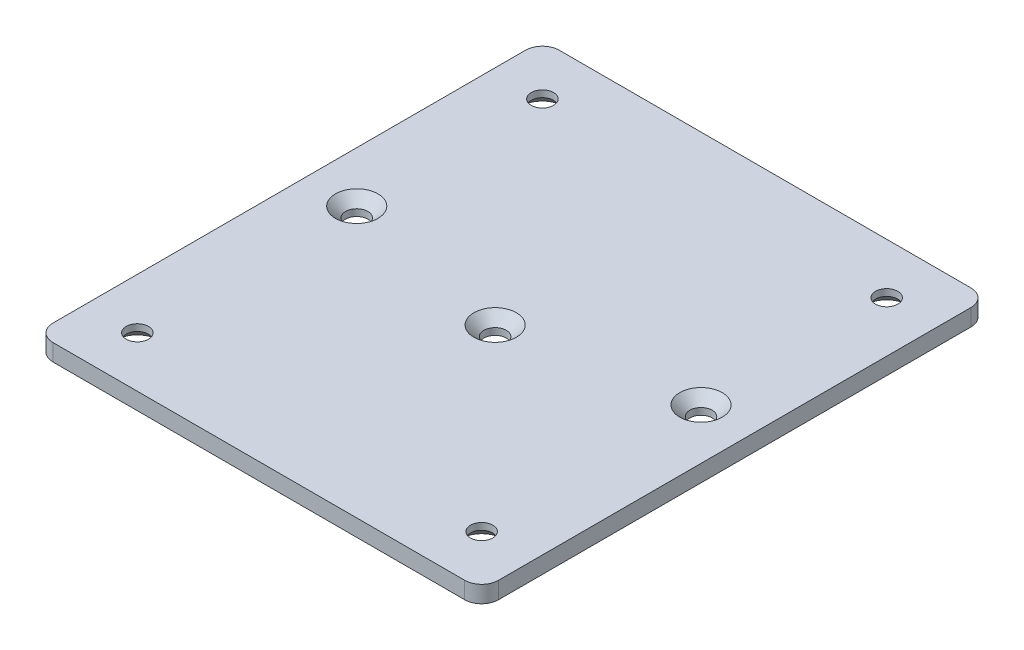
from build123d import *

# Parameters (mm, degrees)
SKETCH1_W                                       = 132
SKETCH1_H                                       = 150
BOSS_EXTRUDE1_DEPTH                             = 5
CSK_FOR_M6_FLAT_HEAD_MACHINE_SCREW1_D           = 6.6
CSK_FOR_M6_FLAT_HEAD_MACHINE_SCREW1_DEPTH       = 10
CSK_FOR_M6_FLAT_HEAD_MACHINE_SCREW1_CSINK_D     = 12.6
CSK_FOR_M6_FLAT_HEAD_MACHINE_SCREW1_CSINK_ANGLE = 90
CSK_FOR_M6_FLAT_HEAD_MACHINE_SCREW1_TIP         = 1.982840043
CSK_FOR_M6_FLAT_HEAD_MACHINE_SCREW2_D           = 6.6
CSK_FOR_M6_FLAT_HEAD_MACHINE_SCREW2_DEPTH       = 10
CSK_FOR_M6_FLAT_HEAD_MACHINE_SCREW2_CSINK_D     = 12.6
CSK_FOR_M6_FLAT_HEAD_MACHINE_SCREW2_CSINK_ANGLE = 90
CSK_FOR_M6_FLAT_HEAD_MACHINE_SCREW2_TIP         = 1.982840043
FILLET1_R                                       = 5


with BuildPart() as part:
    # Sketch1 → Boss-Extrude1 (new body)
    with BuildSketch(Plane(origin=(0, 0, 0), x_dir=(1, 0, 0), z_dir=(0, 1, 0))):
        with Locations((66, 75)):
            Rectangle(SKETCH1_W, SKETCH1_H)
    extrude(amount=BOSS_EXTRUDE1_DEPTH)

    # CSK for M6 Flat Head Machine Screw1
    with Locations(Plane(origin=(0, 5, 0), x_dir=(1, 0, 0), z_dir=(0, 1, 0))):
        with Locations((15, 80), (66, 70), (117, 80)):
            CounterSinkHole(CSK_FOR_M6_FLAT_HEAD_MACHINE_SCREW1_D / 2, CSK_FOR_M6_FLAT_HEAD_MACHINE_SCREW1_CSINK_D / 2, depth=CSK_FOR_M6_FLAT_HEAD_MACHINE_SCREW1_DEPTH, counter_sink_angle=CSK_FOR_M6_FLAT_HEAD_MACHINE_SCREW1_CSINK_ANGLE)
            with Locations((0, 0, -(CSK_FOR_M6_FLAT_HEAD_MACHINE_SCREW1_DEPTH + CSK_FOR_M6_FLAT_HEAD_MACHINE_SCREW1_TIP / 2))):  # 118° drill point
                Cone(0, CSK_FOR_M6_FLAT_HEAD_MACHINE_SCREW1_D / 2, CSK_FOR_M6_FLAT_HEAD_MACHINE_SCREW1_TIP, mode=Mode.SUBTRACT)

    # CSK for M6 Flat Head Machine Screw2
    with Locations(Plane(origin=(0, 0, 0), x_dir=(-1, 0, 0), z_dir=(0, -1, 0))):
        with Locations((-15, 15), (-117, 15), (-117, 135), (-15, 135)):
            CounterSinkHole(CSK_FOR_M6_FLAT_HEAD_MACHINE_SCREW2_D / 2, CSK_FOR_M6_FLAT_HEAD_MACHINE_SCREW2_CSINK_D / 2, depth=CSK_FOR_M6_FLAT_HEAD_MACHINE_SCREW2_DEPTH, counter_sink_angle=CSK_FOR_M6_FLAT_HEAD_MACHINE_SCREW2_CSINK_ANGLE)
            with Locations((0, 0, -(CSK_FOR_M6_FLAT_HEAD_MACHINE_SCREW2_DEPTH + CSK_FOR_M6_FLAT_HEAD_MACHINE_SCREW2_TIP / 2))):  # 118° drill point
                Cone(0, CSK_FOR_M6_FLAT_HEAD_MACHINE_SCREW2_D / 2, CSK_FOR_M6_FLAT_HEAD_MACHINE_SCREW2_TIP, mode=Mode.SUBTRACT)

    # Fillet1
    fillet1_edges = [part.edges().sort_by_distance(p)[0] for p in [
        (0, 2.5, -150),
        (132, 2.5, -150),
        (132, 2.5, 0),
        (0, 2.5, 0),
    ]]
    fillet(fillet1_edges, radius=FILLET1_R)


solid = part.part
